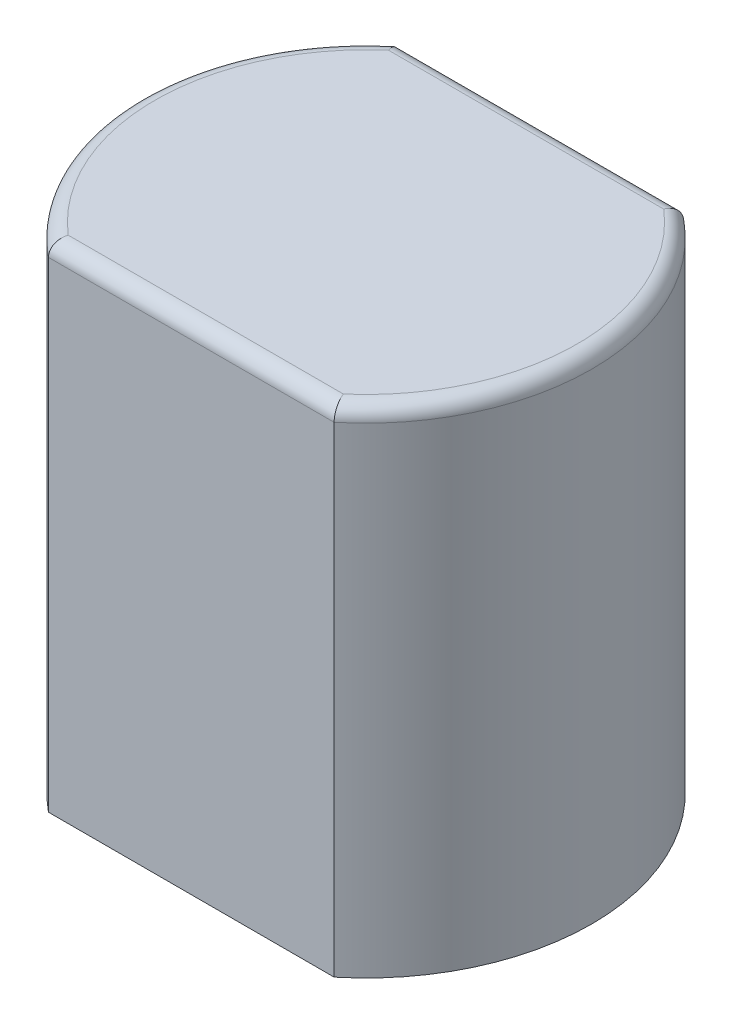
from build123d import *

# Parameters (mm, degrees)
SALIENTE_EXTRUIR1_DEPTH = 17
REDONDEO1_R             = 0.5


with BuildPart() as part:
    # Croquis1 → Saliente-Extruir1 (new body)
    with BuildSketch(Plane(origin=(0, 0, 0), x_dir=(1, 0, 0), z_dir=(0, 1, 0))):
        with BuildLine():
            Line((-4.905354218, -6), (4.905354218, -6))
            ThreePointArc((4.905354218, -6), (7.75, 0), (4.905354218, 6))
            Line((4.905354218, 6), (-4.905354218, 6))
            ThreePointArc((-4.905354218, 6), (-7.75, 0), (-4.905354218, -6))
        make_face()
    extrude(amount=SALIENTE_EXTRUIR1_DEPTH)

    # Redondeo1
    redondeo1_edges = [part.edges().sort_by_distance(p)[0] for p in [
        (-7.75, 17, 0),
        (0, 17, 6),
        (7.75, 17, 0),
        (0, 17, -6),
    ]]
    fillet(redondeo1_edges, radius=REDONDEO1_R)


solid = part.part
